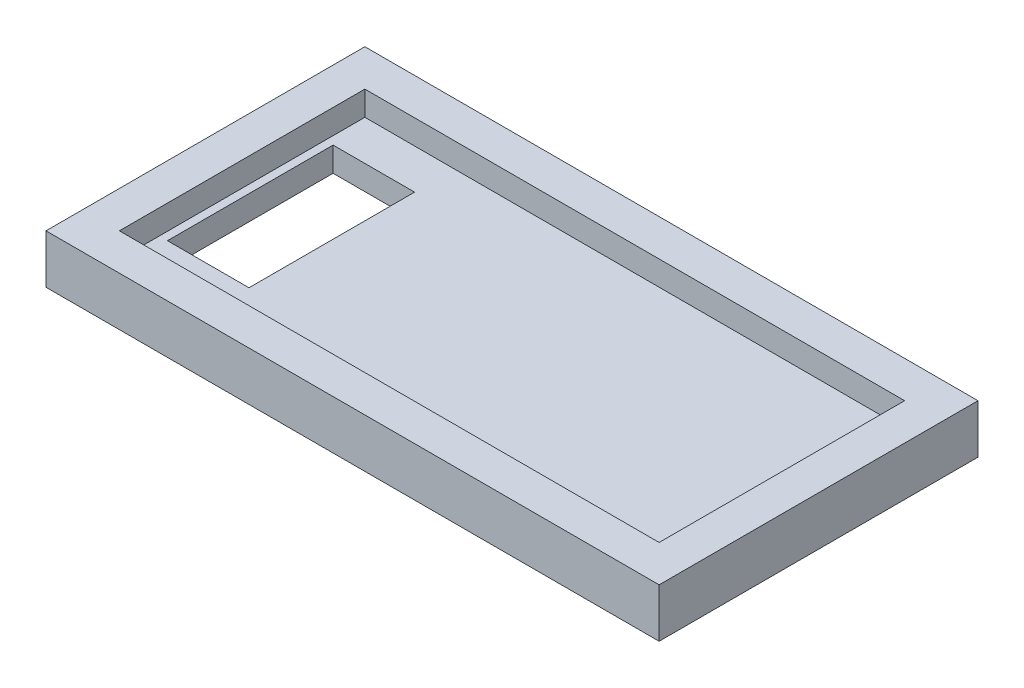
from build123d import *

# Parameters (mm, degrees)
ESBO_O1_W                = 37.61
ESBO_O1_H                = 19.56
BASE_DEPTH               = 3
ESPA_O_START             = 3
ESBO_O4_W                = 33.11
ESBO_O4_H                = 15.06
ESPA_O_SENSOR_DEPTH      = 1.5
RECORTE_START            = 1.5
ESBO_O5_W                = 5
ESBO_O5_H                = 10.16
RECORTE_CONECTORES_DEPTH = 23.907391831
ESBO_O6_R                = 0.75
CORTE_EXTRUS_O3_DEPTH    = 2


with BuildPart() as part:
    # Esboço1 → Base (new body)
    with BuildSketch(Plane(origin=(0, 0, 0), x_dir=(1, 0, 0), z_dir=(0, 1, 0))):
        Rectangle(ESBO_O1_W, ESBO_O1_H)
    extrude(amount=BASE_DEPTH)

    # Esboço4 → Espaço Sensor (cut)
    with BuildSketch(Plane(origin=(0, 0, 0), x_dir=(1, 0, 0), z_dir=(0, 1, 0)).offset(ESPA_O_START)):
        Rectangle(ESBO_O4_W, ESBO_O4_H)
    extrude(amount=-ESPA_O_SENSOR_DEPTH, mode=Mode.SUBTRACT)

    # Esboço5 → Recorte Conectores (cut, through all)
    with BuildSketch(Plane(origin=(0, 0, 0), x_dir=(1, 0, 0), z_dir=(0, 1, 0)).offset(RECORTE_START)):
        with Locations((-13.555, 0)):
            Rectangle(ESBO_O5_W, ESBO_O5_H)
    extrude(amount=-RECORTE_CONECTORES_DEPTH, mode=Mode.SUBTRACT)

    # Esboço6 → Corte-extrusão3 (cut)
    with BuildSketch(Plane(origin=(0, 0, 0), x_dir=(1, 0, 0), z_dir=(0, 1, 0))):
        with Locations(Location((-17.68, -8.655, 0), (0, 0, 270))):
            Circle(ESBO_O6_R)
        with Locations(Location((17.68, -8.655, 0), (0, 0, 270))):
            Circle(ESBO_O6_R)
        with Locations(Location((17.68, 8.655, 0), (0, 0, 270))):
            Circle(ESBO_O6_R)
        with Locations(Location((-17.68, 8.655, 0), (0, 0, 270))):
            Circle(ESBO_O6_R)
    extrude(amount=CORTE_EXTRUS_O3_DEPTH, mode=Mode.SUBTRACT)


solid = part.part
